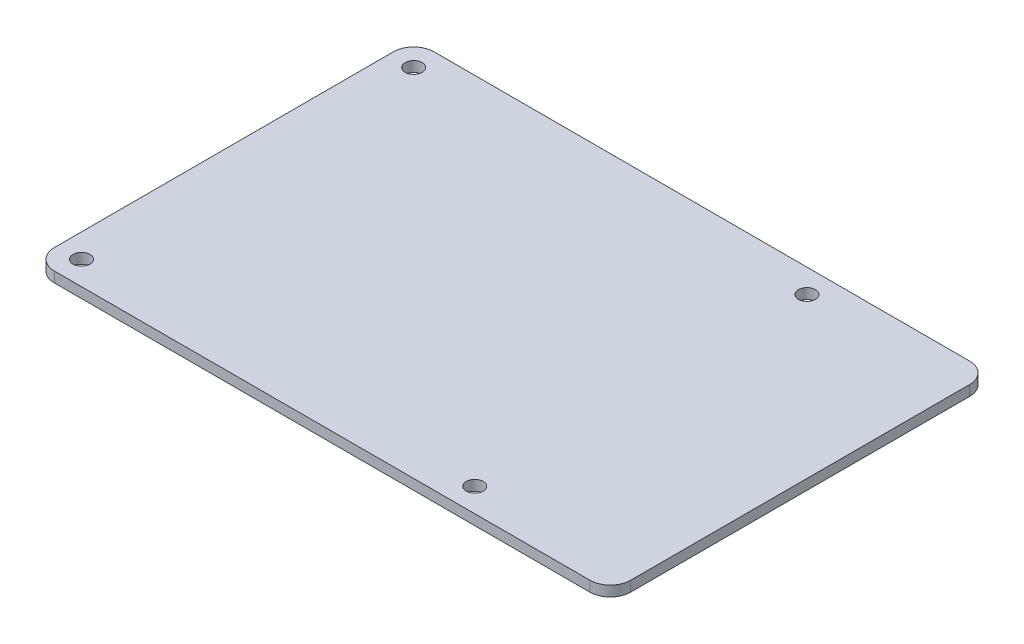
from build123d import *

# Parameters (mm, degrees)
SKETCH1_W           = 85
SKETCH1_H           = 56
SKETCH1_R           = 1.25
BOSS_EXTRUDE1_DEPTH = 1.524
FILLET1_R           = 3


with BuildPart() as part:
    # Sketch1 → Boss-Extrude1 (new body)
    with BuildSketch(Plane(origin=(0, 0, 0), x_dir=(1, 0, 0), z_dir=(0, 1, 0))):
        with Locations((42.5, 28)):
            Rectangle(SKETCH1_W, SKETCH1_H)
        with Locations(Location((61.5, 52.5, 0), (0, 0, 90))):
            Circle(SKETCH1_R, mode=Mode.SUBTRACT)
        with Locations(Location((61.5, 3.5, 0), (0, 0, 90))):
            Circle(SKETCH1_R, mode=Mode.SUBTRACT)
        with Locations(Location((3.5, 3.5, 0), (0, 0, 90))):
            Circle(SKETCH1_R, mode=Mode.SUBTRACT)
        with Locations(Location((3.5, 52.5, 0), (0, 0, 90))):
            Circle(SKETCH1_R, mode=Mode.SUBTRACT)
    extrude(amount=BOSS_EXTRUDE1_DEPTH)

    # Fillet1
    fillet1_edges = [part.edges().sort_by_distance(p)[0] for p in [
        (0, 0.762, -56),
        (85, 0.762, -56),
        (85, 0.762, 0),
        (0, 0.762, 0),
    ]]
    fillet(fillet1_edges, radius=FILLET1_R)


solid = part.part
